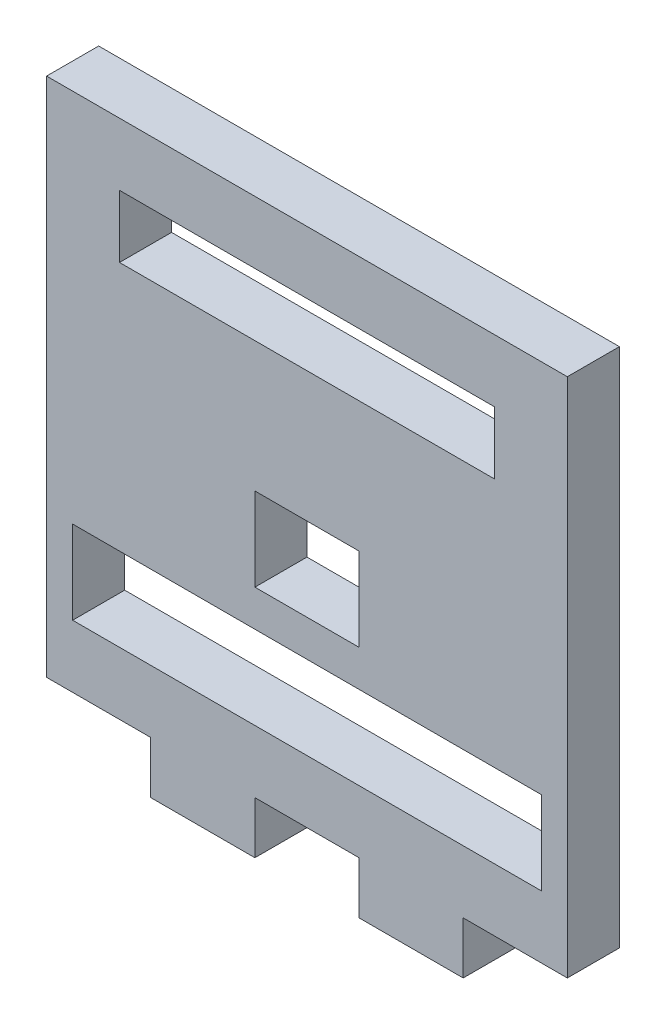
from build123d import *

# Parameters (mm, degrees)
ESQUISSE1_W        = 50
ESQUISSE1_H        = 50
ESQUISSE1_W_2      = 36
ESQUISSE1_H_2      = 6
ESQUISSE1_W_3      = 10
ESQUISSE1_H_3      = 8
ESQUISSE1_W_4      = 45
BOSS_EXTRU_1_DEPTH = 5
ESQUISSE11_W       = 10
ESQUISSE11_H       = 5
BOSS_EXTRU_2_DEPTH = 5


with BuildPart() as part:
    # Esquisse1 → Boss.-Extru.1 (new body)
    with BuildSketch(Plane.XY):
        with Locations((-25, 25)):
            Rectangle(ESQUISSE1_W, ESQUISSE1_H)
        with Locations((-25, 41)):
            Rectangle(ESQUISSE1_W_2, ESQUISSE1_H_2, mode=Mode.SUBTRACT)
        with Locations((-25, 21.5)):
            Rectangle(ESQUISSE1_W_3, ESQUISSE1_H_3, mode=Mode.SUBTRACT)
        with Locations((-25, 10)):
            Rectangle(ESQUISSE1_W_4, ESQUISSE1_H_3, mode=Mode.SUBTRACT)
    extrude(amount=BOSS_EXTRU_1_DEPTH)

    # Esquisse11 → Boss.-Extru.2 (add)
    with BuildSketch(Plane.XY.offset(5)):
        with Locations((-35, -2.5)):
            Rectangle(ESQUISSE11_W, ESQUISSE11_H)
        with Locations((-15, -2.5)):
            Rectangle(ESQUISSE11_W, ESQUISSE11_H)
    extrude(amount=-BOSS_EXTRU_2_DEPTH)


solid = part.part
